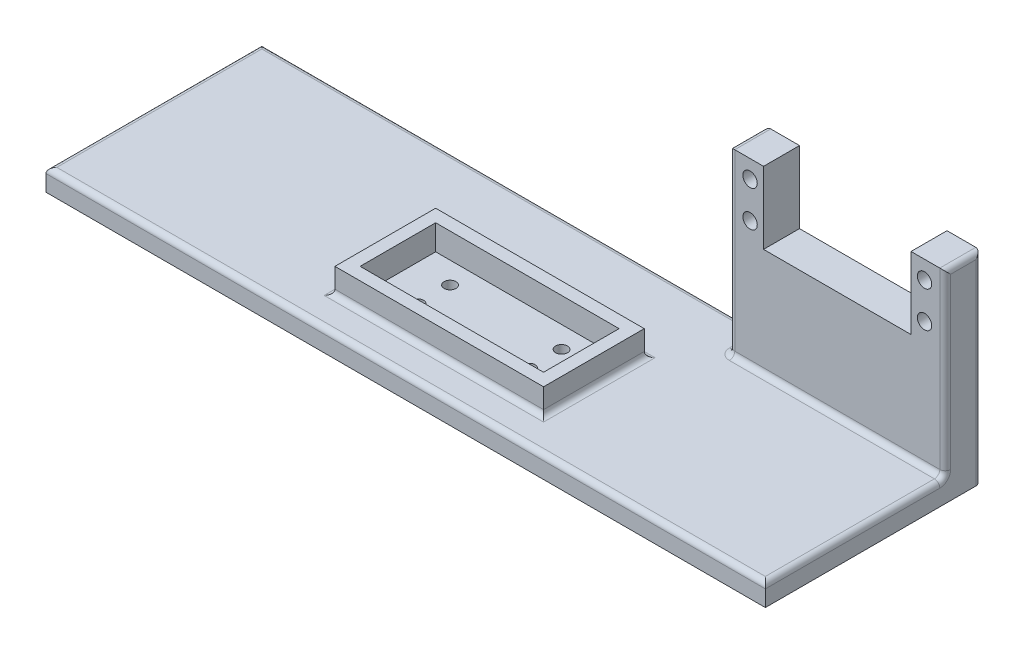
from build123d import *

# Parameters (mm, degrees)
SKETCH8_W           = 200
SKETCH8_H           = 60
BOSS_EXTRUDE6_DEPTH = 6
SKETCH9_W           = 60
SKETCH9_H           = 10
BOSS_EXTRUDE7_DEPTH = 50
SKETCH10_R          = 2
SKETCH10_W          = 41
SKETCH10_H          = 20
CUT_EXTRUDE8_DEPTH  = 10
SKETCH15_W          = 58
SKETCH15_H          = 28
BOSS_EXTRUDE9_DEPTH = 7
SKETCH12_W          = 51
SKETCH12_H          = 21
CUT_EXTRUDE9_DEPTH  = 7
SKETCH13_R          = 3
CUT_EXTRUDE10_DEPTH = 2
SKETCH17_R          = 1.65
CUT_EXTRUDE11_DEPTH = 4
FILLET1_R           = 1.5
FILLET2_R           = 1.5


with BuildPart() as part:
    # Sketch8 → Boss-Extrude6 (new body)
    with BuildSketch(Plane(origin=(0, 0, 0), x_dir=(1, 0, 0), z_dir=(0, 1, 0))):
        Rectangle(SKETCH8_W, SKETCH8_H)
    extrude(amount=BOSS_EXTRUDE6_DEPTH)

    # Sketch9 → Boss-Extrude7 (add)
    with BuildSketch(Plane(origin=(0, 6, 0), x_dir=(1, 0, 0), z_dir=(0, 1, 0))):
        with Locations((70, 25)):
            Rectangle(SKETCH9_W, SKETCH9_H)
    extrude(amount=BOSS_EXTRUDE7_DEPTH)

    # Sketch10 → Cut-Extrude8 (cut)
    with BuildSketch(Plane.XY.offset(-20)):
        with Locations((45.75, 51)):
            Circle(SKETCH10_R)
        with Locations((45.75, 41)):
            Circle(SKETCH10_R)
        with Locations((70, 46)):
            Rectangle(SKETCH10_W, SKETCH10_H)
        with Locations((94.25, 51)):
            Circle(SKETCH10_R)
        with Locations((94.25, 41)):
            Circle(SKETCH10_R)
    extrude(amount=-CUT_EXTRUDE8_DEPTH, mode=Mode.SUBTRACT)

    # Sketch15 → Boss-Extrude9 (add)
    with BuildSketch(Plane(origin=(0, 6, 0), x_dir=(1, 0, 0), z_dir=(0, 1, 0))):
        with Locations((0, -6.66875)):
            Rectangle(SKETCH15_W, SKETCH15_H)
    extrude(amount=BOSS_EXTRUDE9_DEPTH)

    # Sketch12 → Cut-Extrude9 (cut)
    with BuildSketch(Plane(origin=(0, 13, 0), x_dir=(1, 0, 0), z_dir=(0, 1, 0))):
        with Locations((0, -6.66875)):
            Rectangle(SKETCH12_W, SKETCH12_H)
    extrude(amount=-CUT_EXTRUDE9_DEPTH, mode=Mode.SUBTRACT)

    # Sketch13 → Cut-Extrude10 (cut)
    with BuildSketch(Plane(origin=(0, 0, 0), x_dir=(-1, 0, 0), z_dir=(0, -1, 0))):
        with Locations(Location((-15.5, -2.16875, 0), (0, 0, 90))):
            Circle(SKETCH13_R)
        with Locations(Location((-15.5, -11.16875, 0), (0, 0, 90))):
            Circle(SKETCH13_R)
        with Locations(Location((15.5, -2.16875, 0), (0, 0, 90))):
            Circle(SKETCH13_R)
        with Locations(Location((15.5, -11.16875, 0), (0, 0, 90))):
            Circle(SKETCH13_R)
    extrude(amount=-CUT_EXTRUDE10_DEPTH, mode=Mode.SUBTRACT)

    # Sketch17 → Cut-Extrude11 (cut)
    with BuildSketch(Plane.XZ.offset(-2)):
        with Locations(Location((-15.5, 11.16875, 0), (0, 0, 270))):
            Circle(SKETCH17_R)
        with Locations(Location((-15.5, 2.16875, 0), (0, 0, 270))):
            Circle(SKETCH17_R)
        with Locations(Location((15.5, 11.16875, 0), (0, 0, 270))):
            Circle(SKETCH17_R)
        with Locations(Location((15.5, 2.16875, 0), (0, 0, 270))):
            Circle(SKETCH17_R)
    extrude(amount=-CUT_EXTRUDE11_DEPTH, mode=Mode.SUBTRACT)

    # Fillet1
    fillet1_edges = [part.edges().sort_by_distance(p)[0] for p in [
        (-29, 6, 6.66875),
        (0, 6, 20.66875),
        (29, 6, 6.66875),
        (0, 6, -7.33125),
    ]]
    fillet(fillet1_edges, radius=FILLET1_R)

    # Fillet2
    fillet2_edges = [part.edges().sort_by_distance(p)[0] for p in [
        (-100, 6, 0),
        (-30, 6, -30),
        (0, 6, 30),
        (100, 31, -20),
        (40, 6, -25),
        (40, 31, -30),
        (70, 6, -20),
        (40, 31, -20),
        (100, 56, -25),
        (40, 56, -25),
        (100, 6, 5),
        (100, 28, -30),
    ]]
    fillet(fillet2_edges, radius=FILLET2_R)


solid = part.part
